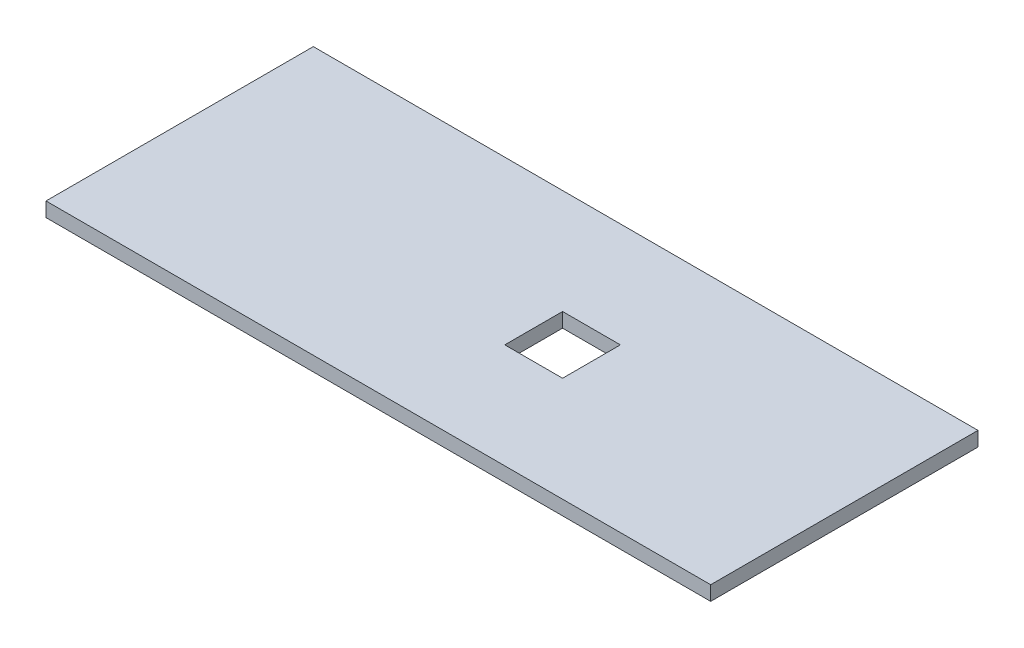
from build123d import *

# Parameters (mm, degrees)
SKETCH1_W           = 184
SKETCH1_H           = 4
BOSS_EXTRUDE1_DEPTH = 74
CUT_EXTRUDE1_DEPTH  = 74


with BuildPart() as part:
    # Sketch1 → Boss-Extrude1 (new body)
    with BuildSketch(Plane.XY):
        with Locations((-92, 2)):
            Rectangle(SKETCH1_W, SKETCH1_H)
    extrude(amount=BOSS_EXTRUDE1_DEPTH)

    # Sketch2 → Cut-Extrude1 (cut)
    with BuildSketch(Plane(origin=(0, 4, 0), x_dir=(1, 0, 0), z_dir=(0, 1, 0))):
        Polygon((-70, -37), (-70, -29), (-86, -29), (-86, -45), (-70, -45), align=None)
    extrude(amount=-CUT_EXTRUDE1_DEPTH, mode=Mode.SUBTRACT)


solid = part.part
